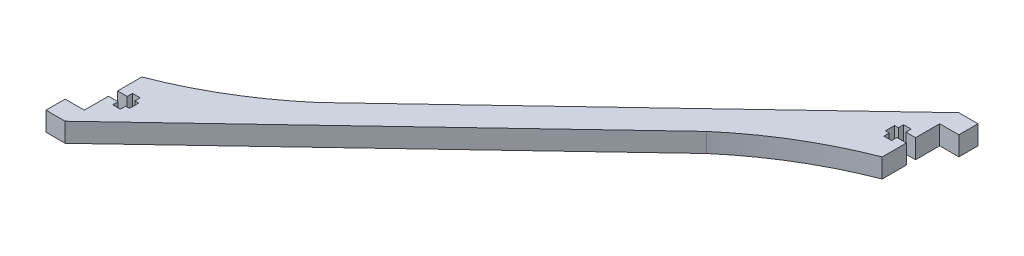
from build123d import *

# Parameters (mm, degrees)
BOSS_EXTRUDE1_DEPTH = 6.35


with BuildPart() as part:
    # Sketch1 → Boss-Extrude1 (new body)
    with BuildSketch(Plane(origin=(0, 0, 0), x_dir=(1, 0, 0), z_dir=(0, 1, 0))):
        with BuildLine():
            Line((1.248119104, -4.675816263), (2.497415053, -4.675816263))
            Line((2.497415053, -4.675816263), (2.497415053, -2.923216263))
            Line((2.497415053, -2.923216263), (5.037415053, -2.923216263))
            Line((5.037415053, -2.923216263), (5.037415053, -4.675816263))
            Line((5.037415053, -4.675816263), (8.212415053, -4.675816263))
            Line((8.212415053, -4.675816263), (8.212415053, -3.02471078))
            Line((8.212415053, -3.02471078), (8.212415053, 3.32528922))
            Line((8.212415053, 3.32528922), (14.562415053, 3.32528922))
            Line((14.562415053, 3.32528922), (14.562415053, 9.67528922))
            Line((14.562415053, 9.67528922), (8.212415053, 9.67528922))
            Line((8.212415053, 9.67528922), (-101.041741874, -93.72811078))
            ThreePointArc((-101.041741874, -93.72811078), (-118.331248541, -106.150388972), (-137.459794183, -115.49591078))
            Line((-137.459794183, -115.49591078), (-137.459794183, -123.496945941))
            Line((-137.459794183, -123.496945941), (-134.284794183, -123.496945941))
            Line((-134.284794183, -123.496945941), (-134.284794183, -121.744345941))
            Line((-134.284794183, -121.744345941), (-131.744794183, -121.744345941))
            Line((-131.744794183, -121.744345941), (-131.744794183, -123.496945941))
            Line((-131.744794183, -123.496945941), (-130.474794183, -123.496945941))
            Line((-130.474794183, -123.496945941), (-130.474794183, -126.544805297))
            Line((-130.474794183, -126.544805297), (-131.744794183, -126.544805297))
            Line((-131.744794183, -126.544805297), (-131.744794183, -128.297405297))
            Line((-131.744794183, -128.297405297), (-134.284794183, -128.297405297))
            Line((-134.284794183, -128.297405297), (-134.284794183, -126.544805297))
            Line((-134.284794183, -126.544805297), (-137.459794183, -126.544805297))
            Line((-137.459794183, -126.544805297), (-137.459794183, -134.54591078))
            Line((-137.459794183, -134.54591078), (-143.809794183, -134.54591078))
            Line((-143.809794183, -134.54591078), (-143.809794183, -140.89591078))
            Line((-143.809794183, -140.89591078), (-137.459794183, -140.89591078))
            Line((-137.459794183, -140.89591078), (-28.205637256, -37.49251078))
            ThreePointArc((-28.205637256, -37.49251078), (-10.916130589, -25.070232587), (8.212415053, -15.72471078))
            Line((8.212415053, -15.72471078), (8.212415053, -7.723675619))
            Line((8.212415053, -7.723675619), (5.037415053, -7.723675619))
            Line((5.037415053, -7.723675619), (5.037415053, -9.476275619))
            Line((5.037415053, -9.476275619), (2.497415053, -9.476275619))
            Line((2.497415053, -9.476275619), (2.497415053, -7.723675619))
            Line((2.497415053, -7.723675619), (1.248119104, -7.723675619))
            Line((1.248119104, -7.723675619), (1.248119104, -4.675816263))
        make_face()
    extrude(amount=BOSS_EXTRUDE1_DEPTH)


solid = part.part
